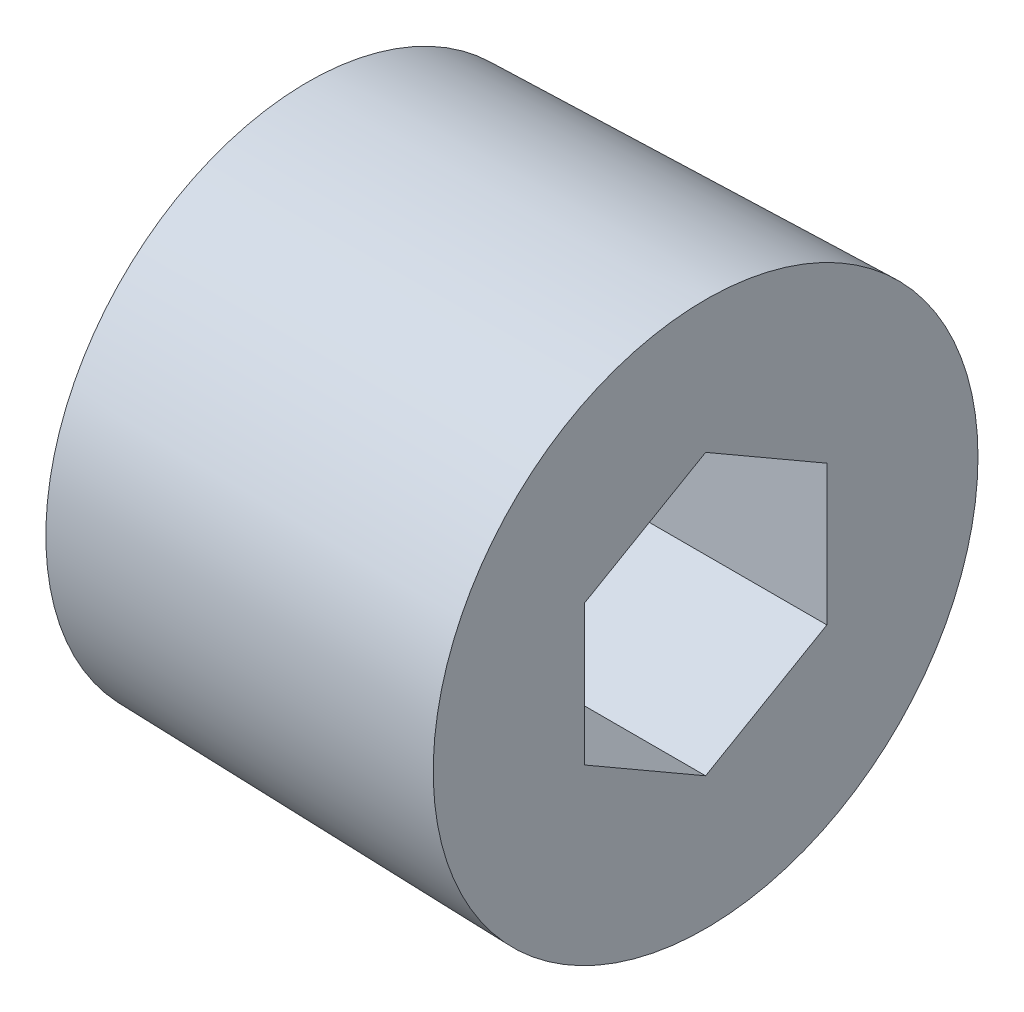
from build123d import *

# Parameters (mm, degrees)
SKETCH2_R          = 6.858
EXTRUDE1_DEPTH     = 10.414
EXTRUDE1_DRAFT     = -1.5
CUT_EXTRUDE7_DEPTH = 5.5626


with BuildPart() as part:
    # Sketch2 → Extrude1 (with draft: the straight prism first)
    with BuildSketch(Plane(origin=(-5.207, 0, 0), x_dir=(0, 0, -1), z_dir=(1, 0, 0))):
        Circle(SKETCH2_R)
    extrude(amount=EXTRUDE1_DEPTH)
    # Extrude1: the draft: its side faces are tilted about the plane it starts from
    extrude1_sides = [part.faces().sort_by_distance(p)[0] for p in [
        (0, 0, 6.858),
    ]]
    draft(extrude1_sides, Plane(origin=(-5.207, 0, 0), x_dir=(0, 0, -1), z_dir=(1, 0, 0)), EXTRUDE1_DRAFT)

    # Sketch6 → Cut-Extrude7 (cut)
    with BuildSketch(Plane(origin=(5.207, 0, 0), x_dir=(0, 0, -1), z_dir=(1, 0, 0))):
        Polygon((0, 3.666174209), (-3.175, 1.833087105), (-3.175, -1.833087105), (0, -3.666174209), (3.175, -1.833087105), (3.175, 1.833087105), align=None)
    extrude(amount=-CUT_EXTRUDE7_DEPTH, mode=Mode.SUBTRACT)


solid = part.part
